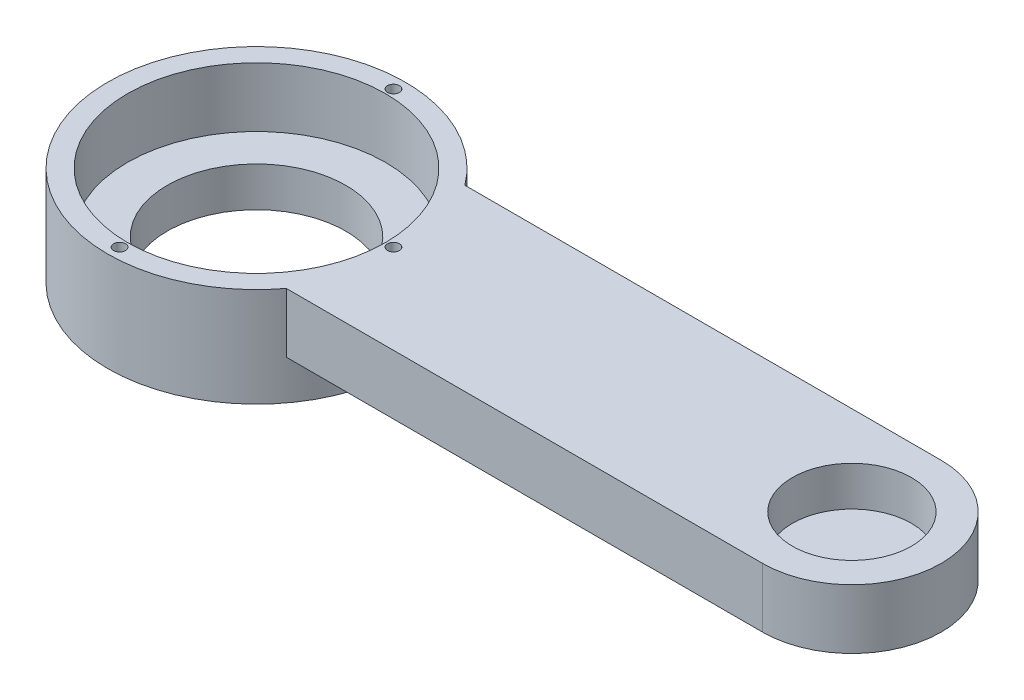
from build123d import *

# Parameters (mm, degrees)
BOSS_EXTRUDE1_DEPTH = 15
SKETCH4_R           = 37.5
BOSS_EXTRUDE2_DEPTH = 25
SKETCH5_R           = 22.5
CUT_EXTRUDE1_DEPTH  = 179.290493297
SKETCH6_R           = 32.5
CUT_EXTRUDE2_DEPTH  = 15
SKETCH7_R           = 15
CUT_EXTRUDE3_DEPTH  = 178.165177165
SKETCH9_R           = 15
BOSS_EXTRUDE3_DEPTH = 5
SKETCH10_R          = 1.5
CUT_EXTRUDE7_DEPTH  = 3


with BuildPart() as part:
    # Sketch2 → Boss-Extrude1 (new body)
    with BuildSketch(Plane(origin=(0, 0, 0), x_dir=(1, 0, 0), z_dir=(0, 1, 0))):
        with BuildLine():
            Line((0, 22.5), (150, 22.5))
            ThreePointArc((150, 22.5), (172.5, 0), (150, -22.5))
            Line((150, -22.5), (0, -22.5))
            ThreePointArc((0, -22.5), (-22.5, 0), (0, 22.5))
        make_face()
    extrude(amount=BOSS_EXTRUDE1_DEPTH)

    # Sketch4 → Boss-Extrude2 (add)
    with BuildSketch(Plane(origin=(0, 15, 0), x_dir=(1, 0, 0), z_dir=(0, 1, 0))):
        with Locations(Location((0, 0, 0), (0, 0, 270))):
            Circle(SKETCH4_R)
    extrude(amount=-BOSS_EXTRUDE2_DEPTH)

    # Sketch5 → Cut-Extrude1 (cut, through all)
    with BuildSketch(Plane(origin=(0, 15, 0), x_dir=(1, 0, 0), z_dir=(0, 1, 0))):
        with Locations(Location((0, 0, 0), (0, 0, 270))):
            Circle(SKETCH5_R)
    extrude(amount=-CUT_EXTRUDE1_DEPTH, mode=Mode.SUBTRACT)

    # Sketch6 → Cut-Extrude2 (cut)
    with BuildSketch(Plane(origin=(0, 15, 0), x_dir=(1, 0, 0), z_dir=(0, 1, 0))):
        with Locations(Location((0, 0, 0), (0, 0, 270))):
            Circle(SKETCH6_R)
    extrude(amount=-CUT_EXTRUDE2_DEPTH, mode=Mode.SUBTRACT)

    # Sketch7 → Cut-Extrude3 (cut, through all)
    with BuildSketch(Plane.XZ):
        with Locations(Location((150, 0, 0), (0, 0, 270))):
            Circle(SKETCH7_R)
    extrude(amount=-CUT_EXTRUDE3_DEPTH, mode=Mode.SUBTRACT)

    # Sketch9 → Boss-Extrude3 (add)
    with BuildSketch(Plane.XZ):
        with Locations(Location((150, 0, 0), (0, 0, 270))):
            Circle(SKETCH9_R)
    extrude(amount=-BOSS_EXTRUDE3_DEPTH)

    # Sketch10 → Cut-Extrude7 (cut)
    with BuildSketch(Plane(origin=(0, 15, 0), x_dir=(1, 0, 0), z_dir=(0, 1, 0))):
        with Locations(Location((0, -34.5, 0), (0, 0, 270))):
            Circle(SKETCH10_R)
        with Locations(Location((34.5, 0, 0), (0, 0, 270))):
            Circle(SKETCH10_R)
        with Locations(Location((0, 34.5, 0), (0, 0, 270))):
            Circle(SKETCH10_R)
    extrude(amount=-CUT_EXTRUDE7_DEPTH, mode=Mode.SUBTRACT)


solid = part.part
